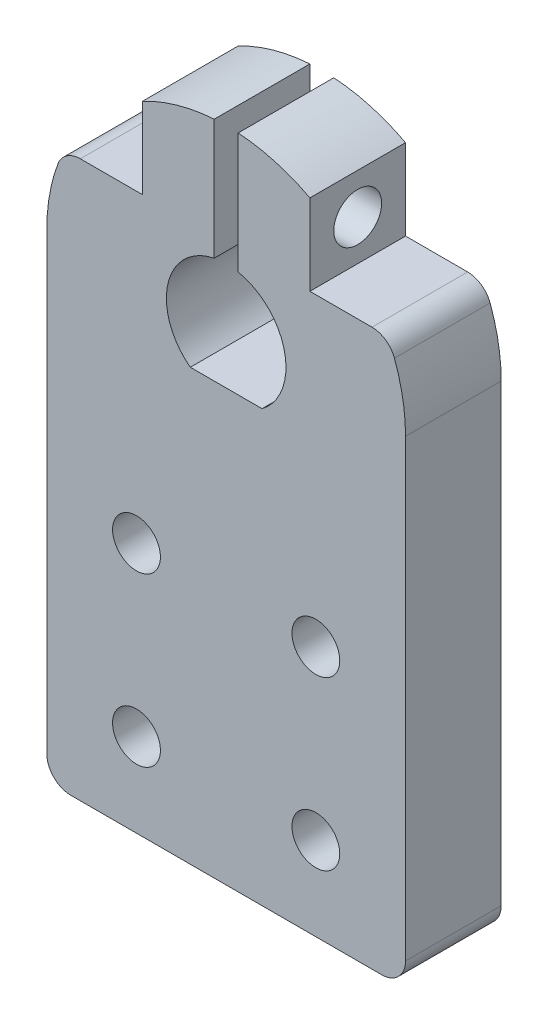
from build123d import *

# Parameters (mm, degrees)
EXTRUDE_1_DEPTH     = 8
SKETCH_2_R          = 2
CUT_EXTRUDE_1_DEPTH = 15
SKETCH_3_R          = 2
CUT_EXTRUDE_2_DEPTH = 15
FILLET_1_R          = 2


with BuildPart() as part:
    # 草图1 → 凸台-拉伸1 (new body)
    with BuildSketch(Plane.XY):
        with BuildLine():
            Line((-15, 0), (-15, -25))
            Line((-15, -25), (-15, -40))
            Line((-15, -40), (15, -40))
            Line((15, -40), (15, 0))
            ThreePointArc((15, 0), (14.624937393, 3.333347603), (13.518505835, 6.5))
            Line((13.518505835, 6.5), (7, 6.5))
            Line((7, 6.5), (7, 13.266499161))
            ThreePointArc((7, 13.266499161), (4.089328898, 14.431818637), (1, 14.966629547))
            Line((1, 14.966629547), (1, 4.898979486))
            ThreePointArc((1, 4.898979486), (4.878315178, 1.096376317), (3, -4))
            Line((3, -4), (-3, -4))
            ThreePointArc((-3, -4), (-4.878315178, 1.096376317), (-1, 4.898979486))
            Line((-1, 4.898979486), (-1, 14.966629547))
            ThreePointArc((-1, 14.966629547), (-4.089328898, 14.431818637), (-7, 13.266499161))
            Line((-7, 13.266499161), (-7, 6.5))
            Line((-7, 6.5), (-13.518505835, 6.5))
            ThreePointArc((-13.518505835, 6.5), (-14.624937393, 3.333347603), (-15, 0))
        make_face()
    extrude(amount=EXTRUDE_1_DEPTH)

    # 草图2 → 切除-拉伸1 (cut)
    with BuildSketch(Plane(origin=(7, 0, 0), x_dir=(0, 0, -1), z_dir=(1, 0, 0))):
        with Locations((-4, 9.883249581)):
            Circle(SKETCH_2_R)
    extrude(amount=-CUT_EXTRUDE_1_DEPTH, mode=Mode.SUBTRACT)

    # 草图3 → 切除-拉伸2 (cut)
    with BuildSketch(Plane.XY.offset(8)):
        with Locations((7.5, -19)):
            Circle(SKETCH_3_R)
        with Locations((7.5, -33)):
            Circle(SKETCH_3_R)
        with Locations((-7.5, -33)):
            Circle(SKETCH_3_R)
        with Locations((-7.5, -19)):
            Circle(SKETCH_3_R)
    extrude(amount=-CUT_EXTRUDE_2_DEPTH, mode=Mode.SUBTRACT)

    # 圆角1
    fillet_1_edges = [part.edges().sort_by_distance(p)[0] for p in [
        (-13.518505835, 6.5, 4),
        (13.518505835, 6.5, 4),
        (15, -40, 4),
        (-15, -40, 4),
    ]]
    fillet(fillet_1_edges, radius=FILLET_1_R)


solid = part.part
